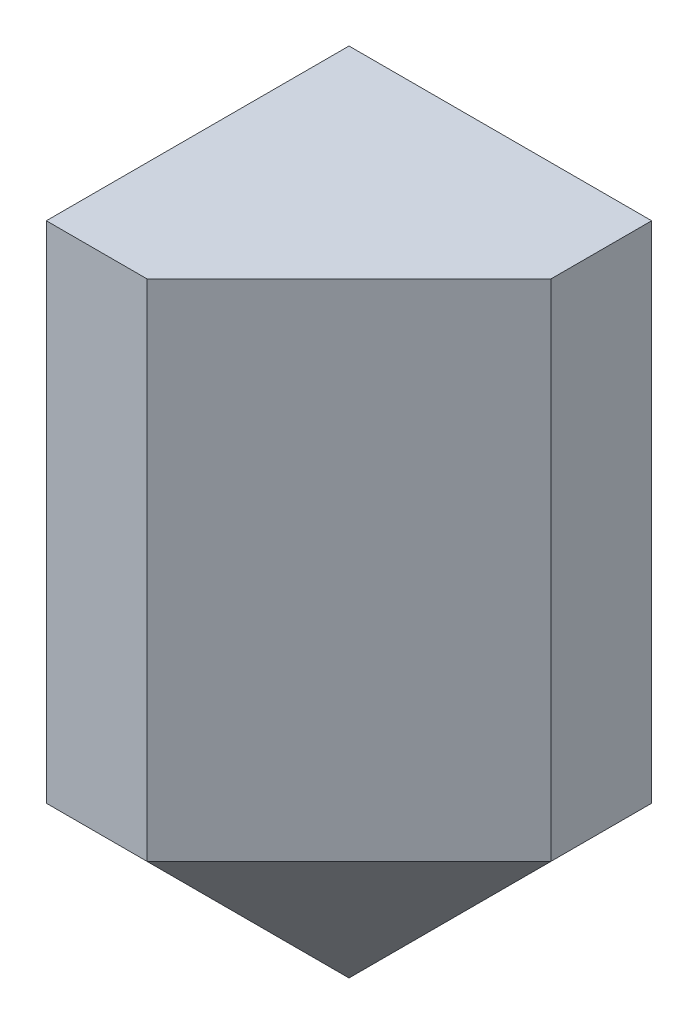
from build123d import *

# Parameters (mm, degrees)
SCHIZZO1_W                   = 30
SCHIZZO1_H                   = 40
ESTRUSIONE_ESTRUSIONE1_DEPTH = 30
SMUSSO1_SIZE                 = 20
ESTRUSIONE_ESTRUSIONE2_DEPTH = 30
FORO_PER_VITE_M5_1_D         = 5.5
FORO_PER_VITE_M5_1_DEPTH     = 13
FORO_PER_VITE_M5_1_TIP       = 1.652366702
FORO_PER_VITE_M5_2_D         = 5.5
FORO_PER_VITE_M5_2_DEPTH     = 13
FORO_PER_VITE_M5_2_TIP       = 1.652366702
SCHIZZO6_R                   = 7.5
TAGLIO_ESTRUSIONE1_DEPTH     = 3
FORO_PER_VITE_M4_1_D         = 4.4
FORO_PER_VITE_M4_1_DEPTH     = 10
FORO_PER_VITE_M4_1_TIP       = 1.321893362


with BuildPart() as part:
    # Schizzo1 → Estrusione-Estrusione1 (new body)
    with BuildSketch(Plane.XY):
        with Locations((15, 20)):
            Rectangle(SCHIZZO1_W, SCHIZZO1_H)
    extrude(amount=ESTRUSIONE_ESTRUSIONE1_DEPTH)

    # Smusso1
    smusso1_edges = [part.edges().sort_by_distance(p)[0] for p in [
        (30, 20, 30),
        (30, 0, 15),
        (15, 0, 30),
    ]]
    chamfer(smusso1_edges, length=SMUSSO1_SIZE)

    # Schizzo2 → Estrusione-Estrusione2 (add)
    with BuildSketch(Plane(origin=(0, 40, 0), x_dir=(1, 0, 0), z_dir=(0, 1, 0))):
        Polygon((0, 0), (30, 0), (30, -10), (10, -30), (0, -30), align=None)
    extrude(amount=ESTRUSIONE_ESTRUSIONE2_DEPTH)

    # Foro per Vite M5-1
    with Locations(Plane.ZY):
        with Locations((18, 20)):
            Hole(FORO_PER_VITE_M5_1_D / 2, depth=FORO_PER_VITE_M5_1_DEPTH)
            with Locations((0, 0, -(FORO_PER_VITE_M5_1_DEPTH + FORO_PER_VITE_M5_1_TIP / 2))):  # 118° drill point
                Cone(0, FORO_PER_VITE_M5_1_D / 2, FORO_PER_VITE_M5_1_TIP, mode=Mode.SUBTRACT)

    # Foro per Vite M5-2
    with Locations(Plane(origin=(14, 20, 0), x_dir=(-1, 0, 0), z_dir=(0, 0, -1))):
        with Locations((0, 0), (0, 28)):
            Hole(FORO_PER_VITE_M5_2_D / 2, depth=FORO_PER_VITE_M5_2_DEPTH)
            with Locations((0, 0, -(FORO_PER_VITE_M5_2_DEPTH + FORO_PER_VITE_M5_2_TIP / 2))):  # 118° drill point
                Cone(0, FORO_PER_VITE_M5_2_D / 2, FORO_PER_VITE_M5_2_TIP, mode=Mode.SUBTRACT)

    # Schizzo6 → Taglio-Estrusione1 (cut)
    with BuildSketch(Plane.ZY):
        with Locations((15, 55)):
            Circle(SCHIZZO6_R)
    extrude(amount=-TAGLIO_ESTRUSIONE1_DEPTH, mode=Mode.SUBTRACT)

    # Foro per Vite M4-1
    with Locations(Plane.ZY.offset(-3)):
        with Locations((15, 55)):
            Hole(FORO_PER_VITE_M4_1_D / 2, depth=FORO_PER_VITE_M4_1_DEPTH)
            with Locations((0, 0, -(FORO_PER_VITE_M4_1_DEPTH + FORO_PER_VITE_M4_1_TIP / 2))):  # 118° drill point
                Cone(0, FORO_PER_VITE_M4_1_D / 2, FORO_PER_VITE_M4_1_TIP, mode=Mode.SUBTRACT)


solid = part.part
